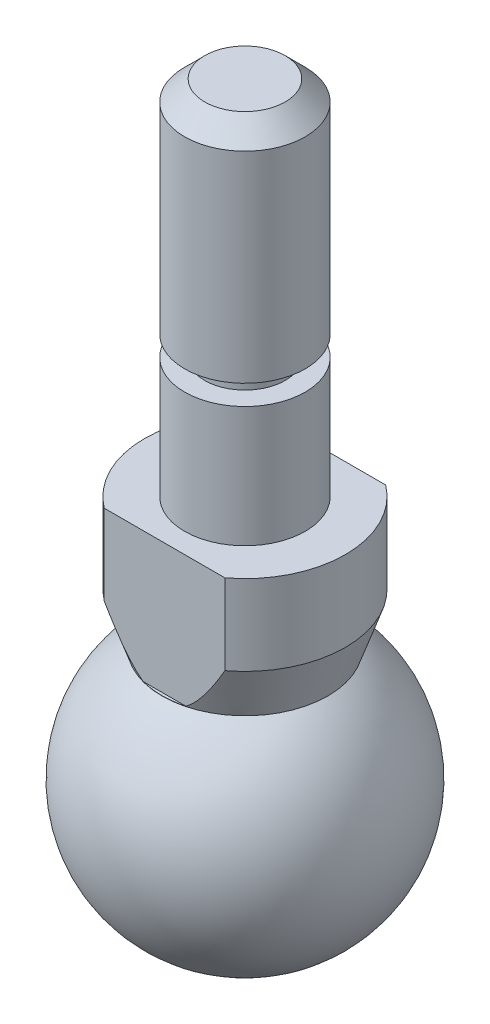
from build123d import *

# Parameters (mm, degrees)
CHAMFER_1_SIZE      = 1
SKETCH_2_W          = 13.14097419
SKETCH_2_H          = 3.873114836
CUT_EXTRUDE_1_DEPTH = 6.5


with BuildPart() as part:
    # 草图1 → 旋转1 (revolve)
    with BuildSketch(Plane.XY, mode=Mode.PRIVATE) as revolve_1_sk:
        with BuildLine():
            Line((4.131730263, 5.65055794), (5, 8.175))
            Line((5, 8.175), (5, 12.175))
            Line((5, 12.175), (3, 12.175))
            Line((3, 12.175), (3, 18.175))
            Line((3, 18.175), (2, 18.175))
            Line((2, 18.175), (2, 19.175))
            Line((2, 19.175), (3, 19.175))
            Line((3, 19.175), (3, 30.175))
            Line((3, 30.175), (0, 30.175))
            Line((0, 30.175), (0, -7))
            ThreePointArc((0, -7), (6.654092935, -2.173257281), (4.131730263, 5.65055794))
        make_face()
    revolve(revolve_1_sk.sketch.rotate(Axis((0, 30.175, 0), (0, -1, 0)), 90), axis=Axis((0, 30.175, 0), (0, -1, 0)))

    # 倒角1
    chamfer_1_edges = [part.edges().sort_by_distance(p)[0] for p in [
        (0, 30.175, -3),
    ]]
    chamfer(chamfer_1_edges, length=CHAMFER_1_SIZE)

    # 草图2 → 切除-拉伸1 (cut)
    with BuildSketch(Plane(origin=(0, 12.175, 0), x_dir=(1, 0, 0), z_dir=(0, 1, 0))):
        with Locations((1.143581663, -5.936557418)):
            Rectangle(SKETCH_2_W, SKETCH_2_H)
        with Locations((1.143581663, 5.936557418)):
            Rectangle(SKETCH_2_W, SKETCH_2_H)
    extrude(amount=-CUT_EXTRUDE_1_DEPTH, mode=Mode.SUBTRACT)


solid = part.part
